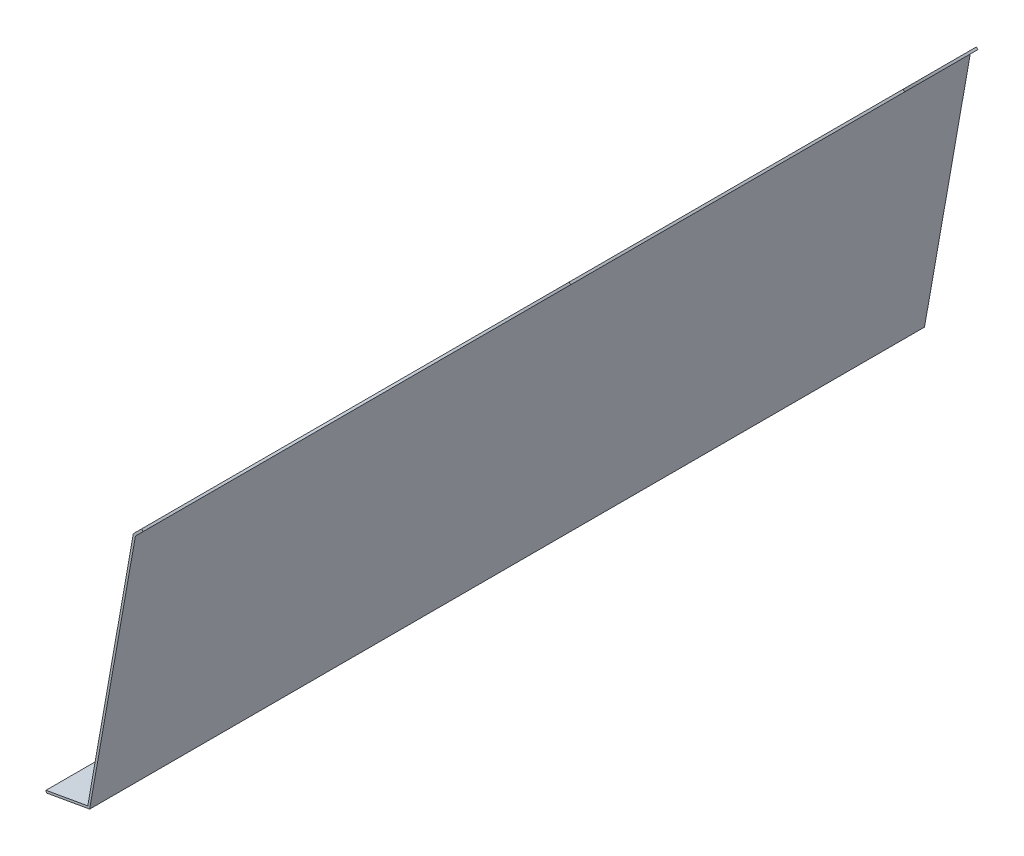
from build123d import *

# Parameters (mm, degrees)
EXTRUDE_1_DEPTH     = 380
SKETCH_2_R          = 1.5
CUT_EXTRUDE_1_DEPTH = 3


with BuildPart() as part:
    # 草图1 → 凸台-拉伸1 (new body)
    with BuildSketch(Plane.XY):
        Polygon((-133.074926411, -194.523734135), (-152.081511659, -197.875107926), (-151.907863481, -198.859915679), (-132.211708421, -195.386952125), (-111.394108644, -77.324476981), (-27.25197302, 6.817658643), (-27.959079801, 7.524765424), (-112.324165337, -76.840320111), align=None)
    extrude(amount=EXTRUDE_1_DEPTH)

    # 草图2 → 切除-拉伸1 (cut)
    with BuildSketch(Plane(origin=(-17.034815832, 17.034815832, 0), x_dir=(0, 0, -1), z_dir=(0.7071067811865477, -0.7071067811865475, 0))):
        with Locations(Location((-254.5, -38.449242265, 0), (0, 0, 90))):
            Circle(SKETCH_2_R)
        with Locations(Location((-254.5, -50.449242265, 0), (0, 0, 90))):
            Circle(SKETCH_2_R)
        with BuildLine():
            ThreePointArc((-380, -128.449242265), (-299.389826945, -95.05941532), (-266, -14.449242265))
            Line((-266, -14.449242265), (-380, -14.449242265))
            Line((-380, -14.449242265), (-380, -128.449242265))
        make_face()
        with BuildLine():
            Line((-380, -14.449242265), (-266, -14.449242265))
            ThreePointArc((-266, -14.449242265), (-460.610173055, 66.16093079), (-380, -128.449242265))
            Line((-380, -128.449242265), (-380, -14.449242265))
        make_face()
        with BuildLine():
            ThreePointArc((114, -14.449242265), (0, 99.550757735), (-114, -14.449242265))
            Line((-114, -14.449242265), (0, -14.449242265))
            Line((0, -14.449242265), (0, -128.449242265))
            ThreePointArc((0, -128.449242265), (80.610173055, -95.05941532), (114, -14.449242265))
        make_face()
        with BuildLine():
            Line((0, -14.449242265), (-114, -14.449242265))
            ThreePointArc((-114, -14.449242265), (-80.610173055, -95.05941532), (0, -128.449242265))
            Line((0, -128.449242265), (0, -14.449242265))
        make_face()
        with Locations(Location((-125.5, -38.449242265, 0), (0, 0, 90))):
            Circle(SKETCH_2_R)
        with Locations(Location((-125.5, -50.449242265, 0), (0, 0, 90))):
            Circle(SKETCH_2_R)
        with Locations(Location((-125.5, -78.449242265, 0), (0, 0, 90))):
            Circle(SKETCH_2_R)
        with Locations(Location((-125.5, -90.449242265, 0), (0, 0, 90))):
            Circle(SKETCH_2_R)
        with Locations(Location((-254.5, -90.449242265, 0), (0, 0, 90))):
            Circle(SKETCH_2_R)
        with Locations(Location((-254.5, -78.449242265, 0), (0, 0, 90))):
            Circle(SKETCH_2_R)
    extrude(amount=-CUT_EXTRUDE_1_DEPTH, mode=Mode.SUBTRACT)


solid = part.part
